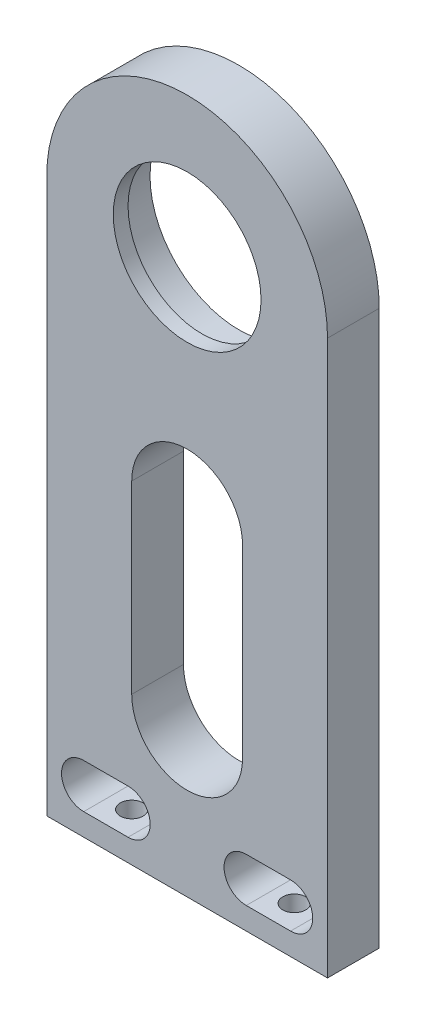
from build123d import *

# Parameters (mm, degrees)
SKETCH_1_R         = 10
SKETCH_1_R_2       = 19
EXTRUDE_1_DEPTH    = 7
SKETCH2_R          = 12.025
CUT_EXTRUDE2_DEPTH = 5
SKETCH3_R          = 1.55
CUT_EXTRUDE3_DEPTH = 5


with BuildPart() as part:
    # 草图1 → 凸台-拉伸1 (new body)
    # profile 1 of 3: a face of its own
    with BuildSketch(Plane.XY):
        with BuildLine():
            ThreePointArc((19, 75), (0, 94), (-19, 75))
            ThreePointArc((-19, 75), (0, 56), (19, 75))
        make_face()
        with Locations((0, 75)):
            Circle(SKETCH_1_R, mode=Mode.SUBTRACT)
    # profile 2 of 3: a face of its own
    with BuildSketch(Plane.XY):
        with BuildLine():
            Line((-19, 7), (-19, 0))
            Line((-19, 0), (19, 0))
            Line((19, 0), (19, 7))
            Line((19, 7), (19, 75))
            ThreePointArc((19, 75), (0, 56), (-19, 75))
            Line((-19, 75), (-19, 7))
        make_face()
        with BuildLine():
            ThreePointArc((-8, 9), (-5, 6), (-8, 3))
            Line((-8, 3), (-14, 3))
            ThreePointArc((-14, 3), (-17, 6), (-14, 9))
            Line((-14, 9), (-8, 9))
        make_face(mode=Mode.SUBTRACT)
        with BuildLine():
            Line((14, 3), (8, 3))
            ThreePointArc((8, 3), (5, 6), (8, 9))
            Line((8, 9), (14, 9))
            ThreePointArc((14, 9), (17, 6), (14, 3))
        make_face(mode=Mode.SUBTRACT)
        with BuildLine():
            ThreePointArc((-7.5, 45), (0, 52.5), (7.5, 45))
            Line((7.5, 45), (7.5, 20))
            ThreePointArc((7.5, 20), (0, 12.5), (-7.5, 20))
            Line((-7.5, 20), (-7.5, 45))
        make_face(mode=Mode.SUBTRACT)
    # profile 3 of 3: a face of its own
    with BuildSketch(Plane.XY):
        with Locations((0, 75)):
            Circle(SKETCH_1_R_2)
        with Locations((0, 75)):
            Circle(SKETCH_1_R, mode=Mode.SUBTRACT)
    extrude(amount=EXTRUDE_1_DEPTH)

    # Sketch2 → Cut-Extrude2 (cut)
    with BuildSketch(Plane(origin=(0, 0, 0), x_dir=(-1, 0, 0), z_dir=(0, 0, -1))):
        with Locations((0, 75)):
            Circle(SKETCH2_R)
    extrude(amount=-CUT_EXTRUDE2_DEPTH, mode=Mode.SUBTRACT)

    # Sketch3 → Cut-Extrude3 (cut)
    with BuildSketch(Plane.XZ):
        with Locations(Location((11, 3.5, 0), (0, 0, 270))):
            Circle(SKETCH3_R)
        with Locations((-11, 3.5)):
            Circle(SKETCH3_R)
    extrude(amount=-CUT_EXTRUDE3_DEPTH, mode=Mode.SUBTRACT)


solid = part.part
